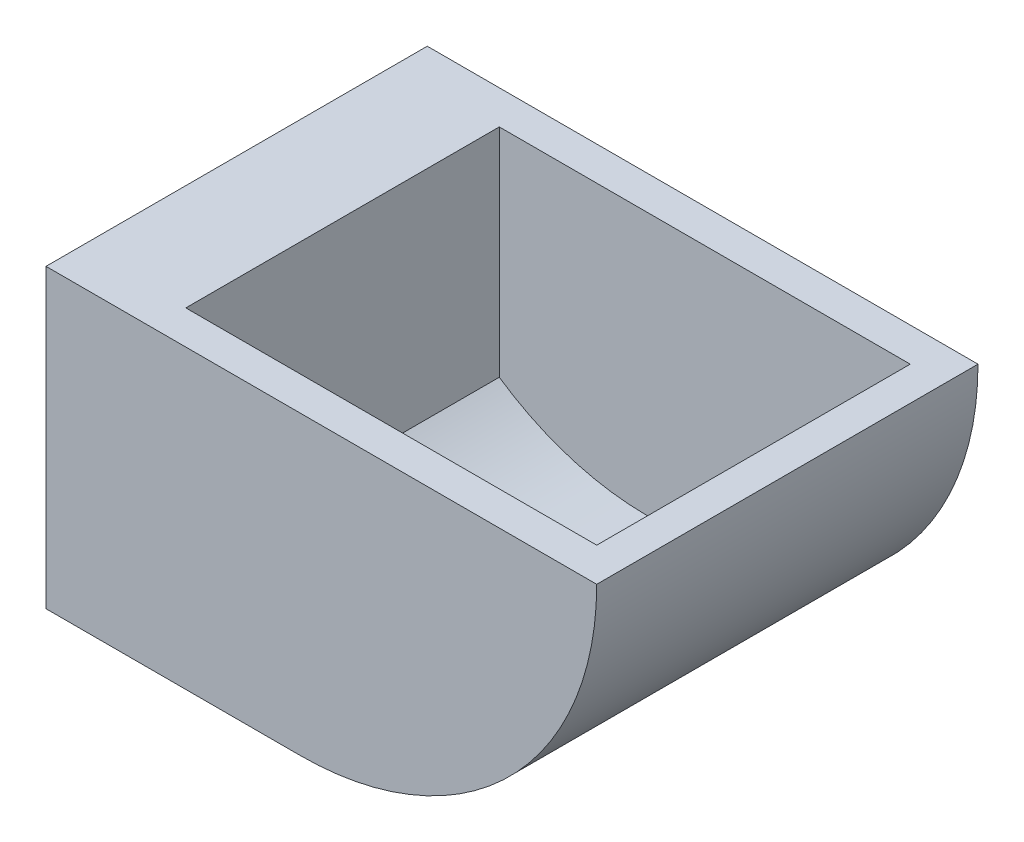
from build123d import *

# Parameters (mm, degrees)
BOSS_EXTRUDE1_DEPTH = 45
SKETCH2_W           = 31
SKETCH2_H           = 37
BOSS_EXTRUDE3_START = -45
BOSS_EXTRUDE3_DEPTH = 45
SKETCH4_R           = 5.15
CUT_EXTRUDE1_DEPTH  = 12
SKETCH5_W           = 5
SKETCH5_H           = 35
CUT_EXTRUDE2_DEPTH  = 67.895440801


with BuildPart() as part:
    # Sketch1 → Boss-Extrude1 (new body)
    with BuildSketch(Plane.XY):
        with BuildLine():
            Line((35, 0), (-35, 0))
            ThreePointArc((-35, 0), (0, -35), (35, 0))
        make_face()
    extrude(amount=BOSS_EXTRUDE1_DEPTH)

    # Sketch2 → Cut-Revolve1 (revolve, cut)
    with BuildSketch(Plane(origin=(0, 0, 0), x_dir=(1, 0, 0), z_dir=(0, 1, 0))):
        with Locations((-15.5, -22.5)):
            Rectangle(SKETCH2_W, SKETCH2_H)
    revolve(axis=Axis((0, 0, 0), (0, 0, 1)), mode=Mode.SUBTRACT)

    # Sketch3 → Boss-Extrude3 (add)
    with BuildSketch(Plane.XY.offset(45).offset(BOSS_EXTRUDE3_START)):
        with BuildLine():
            Line((-17.5, -30.310889132), (-17.5, 0))
            Line((-17.5, 0), (-35, 0))
            Line((-35, 0), (-35, -35))
            Line((-35, -35), (0, -35))
            ThreePointArc((0, -35), (-9.058666579, -33.80740392), (-17.5, -30.310889132))
        make_face()
    extrude(amount=BOSS_EXTRUDE3_DEPTH)

    # Sketch4 → Cut-Extrude1 (cut)
    with BuildSketch(Plane.ZY.offset(35)):
        with Locations((10, -17.5)):
            Circle(SKETCH4_R)
        with Locations((35, -17.5)):
            Circle(SKETCH4_R)
    extrude(amount=-CUT_EXTRUDE1_DEPTH, mode=Mode.SUBTRACT)

    # Sketch5 → Cut-Extrude2 (cut, through all)
    with BuildSketch(Plane(origin=(0, 0, 0), x_dir=(-1, 0, 0), z_dir=(0, 0, -1))):
        with Locations((32.5, -17.5)):
            Rectangle(SKETCH5_W, SKETCH5_H)
    extrude(amount=-CUT_EXTRUDE2_DEPTH, mode=Mode.SUBTRACT)


solid = part.part
